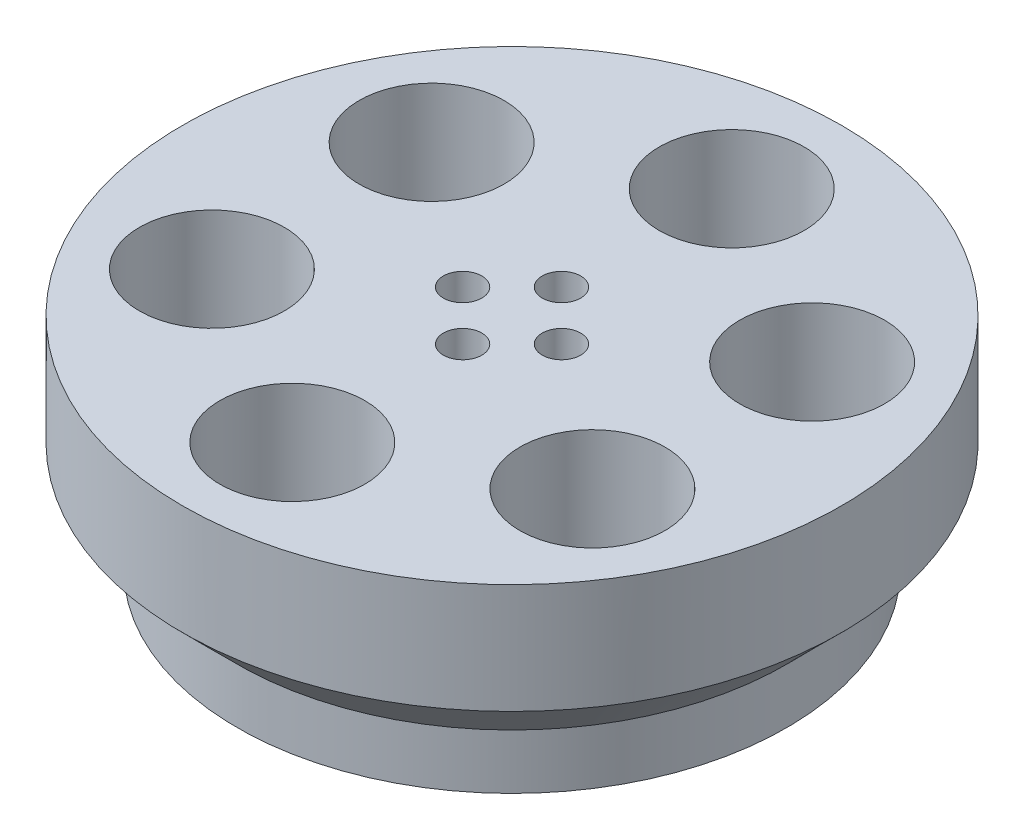
from build123d import *

# Parameters (mm, degrees)
SKETCH1_R           = 30
BOSS_EXTRUDE1_DEPTH = 20
SKETCH2_R           = 6.6
CUT_EXTRUDE1_DEPTH  = 10
SKETCH3_R           = 2
CUT_EXTRUDE2_DEPTH  = 35
CIRPATTERN1_COUNT   = 6
SKETCH6_R           = 1.75
CUT_EXTRUDE4_DEPTH  = 45
CIRPATTERN3_COUNT   = 4


with BuildPart() as part:
    # Sketch1 → Boss-Extrude1 (new body)
    with BuildSketch(Plane(origin=(0, 0, 0), x_dir=(1, 0, 0), z_dir=(0, 1, 0))):
        with Locations(Location((0, 0, 0), (0, 0, 270))):
            Circle(SKETCH1_R)
    extrude(amount=BOSS_EXTRUDE1_DEPTH)

    # Sketch2 → Cut-Extrude1 (cut)
    with BuildSketch(Plane(origin=(0, 20, 0), x_dir=(1, 0, 0), z_dir=(0, 1, 0))):
        with Locations(Location((0, 20, 0), (0, 0, 270))):
            Circle(SKETCH2_R)
    cut_extrude1 = extrude(amount=-CUT_EXTRUDE1_DEPTH, mode=Mode.SUBTRACT)

    # Sketch3 → Cut-Extrude2 (cut)
    with BuildSketch(Plane(origin=(0, 10, 0), x_dir=(1, 0, 0), z_dir=(0, 1, 0))):
        with Locations(Location((0, 20, 0), (0, 0, 270))):
            Circle(SKETCH3_R)
    cut_extrude2 = extrude(amount=-CUT_EXTRUDE2_DEPTH, mode=Mode.SUBTRACT)

    # CirPattern1: Cut-Extrude1, Cut-Extrude2 ×6 about axis
    cirpattern1_axis = Axis((0, 0, 0), (0, 1, 0))
    add([cut_extrude1.rotate(cirpattern1_axis, i * 360 / CIRPATTERN1_COUNT) for i in range(1, CIRPATTERN1_COUNT)], mode=Mode.SUBTRACT)
    add([cut_extrude2.rotate(cirpattern1_axis, i * 360 / CIRPATTERN1_COUNT) for i in range(1, CIRPATTERN1_COUNT)], mode=Mode.SUBTRACT)

    # Sketch6 → Cut-Extrude4 (cut)
    with BuildSketch(Plane(origin=(0, 20, 0), x_dir=(1, 0, 0), z_dir=(0, 1, 0))):
        with Locations(Location((4.5, 0, 0), (0, 0, 270))):
            Circle(SKETCH6_R)
    cut_extrude4 = extrude(amount=-CUT_EXTRUDE4_DEPTH, mode=Mode.SUBTRACT)

    # CirPattern3: Cut-Extrude4 ×4 about axis
    cirpattern3_axis = Axis((0, 0, 0), (0, 1, 0))
    for i in range(1, CIRPATTERN3_COUNT):
        add(cut_extrude4.rotate(cirpattern3_axis, i * 360 / CIRPATTERN3_COUNT), mode=Mode.SUBTRACT)

    # Sketch7 → Cut-Revolve1 (revolve, cut)
    with BuildSketch(Plane.XY, mode=Mode.PRIVATE) as cut_revolve1_sk:
        Polygon((-25, 0), (-25, 5), (-30, 10), (-30, 0), align=None)
    revolve(cut_revolve1_sk.sketch.rotate(Axis((0, 0, 0), (0, 1, 0)), 270), axis=Axis((0, 0, 0), (0, 1, 0)), mode=Mode.SUBTRACT)


solid = part.part
